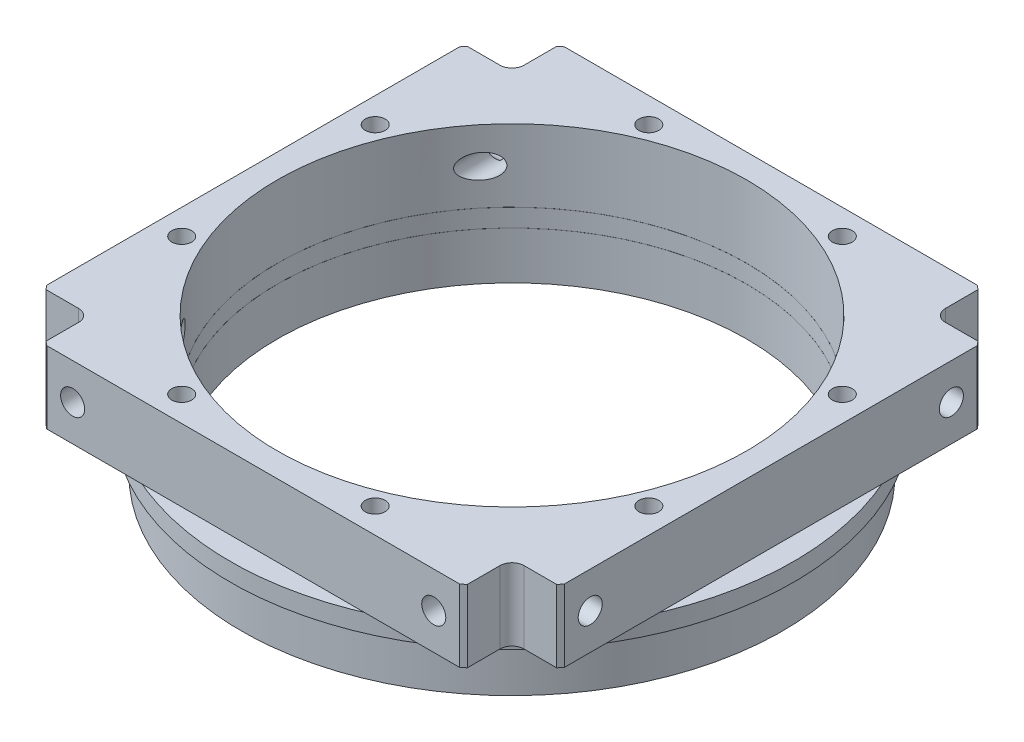
from build123d import *

# Parameters (mm, degrees)
SKETCH_2_OUTSIDE_W          = 143.448
SKETCH_2_OUTSIDE_H          = 143.448
SKETCH_2_OUTSIDE_W_2        = 86
SKETCH_2_OUTSIDE_H_2        = 86
CUT_EXTRUDE_1_DEPTH         = 12
SKETCH_4_R                  = 2
CUT_EXTRUDE_3_DEPTH         = 104.820470043
SKETCH_5_R                  = 2
CUT_EXTRUDE_4_DEPTH         = 12
CUT_EXTRUDE_START           = -74
SKETCH_5_2_R                = 2
CUT_EXTRUDE_5_DEPTH         = 12
SKETCH_6_R                  = 1.65
CUT_EXTRUDE_6_DEPTH         = 100
SKETCH_10_R                 = 2.1
CUT_EXTRUDE_8_DEPTH         = 10.9
PATTERN_CIRCULAR_1_COUNT    = 8
CUT_EXTRUDE_7_DEPTH         = 20
CUT_EXTRUDE_3326_DEPTH      = 71.034919894
CUT_EXTRUDE_3326_DEPTH_BACK = 71.034919894
SKETCH_11_W                 = 136.197392648
SKETCH_11_H                 = 0.01


with BuildPart() as part:
    # 草图1 → 旋转1 (revolve)
    with BuildSketch(Plane.XY, mode=Mode.PRIVATE) as revolve_1_sk:
        Polygon((-39, 0), (-45, 0), (-45, 7.9), (-46.8, 7.9), (-46.8, 10.9), (-55, 10.9), (-55, 22.9), (-39, 22.9), align=None)
    revolve(revolve_1_sk.sketch.rotate(Axis((0, 0, 0), (0, 1, 0)), 270), axis=Axis((0, 0, 0), (0, 1, 0)))

    # 草图2 outside → 切除-拉伸1 (cut)
    with BuildSketch(Plane(origin=(0, 22.9, 0), x_dir=(1, 0, 0), z_dir=(0, 1, 0))):
        Rectangle(SKETCH_2_OUTSIDE_W, SKETCH_2_OUTSIDE_H)
        Rectangle(SKETCH_2_OUTSIDE_W_2, SKETCH_2_OUTSIDE_H_2, mode=Mode.SUBTRACT)
    extrude(amount=-CUT_EXTRUDE_1_DEPTH, mode=Mode.SUBTRACT)

    # 草图4 → 切除-拉伸3 (cut, through all)
    with BuildSketch(Plane.XY.offset(43)):
        with Locations((-30, 16.9)):
            Circle(SKETCH_4_R)
        with Locations((30, 16.9)):
            Circle(SKETCH_4_R)
    extrude(amount=-CUT_EXTRUDE_3_DEPTH, mode=Mode.SUBTRACT)

    # 草图5 → 切除-拉伸4 (cut)
    with BuildSketch(Plane.ZY.offset(43)):
        with Locations((-30, 16.9)):
            Circle(SKETCH_5_R)
        with Locations((30, 16.9)):
            Circle(SKETCH_5_R)
    extrude(amount=-CUT_EXTRUDE_4_DEPTH, mode=Mode.SUBTRACT)

    # 草图5<2> → 切除-拉伸5 (cut)
    with BuildSketch(Plane.ZY.offset(43).offset(CUT_EXTRUDE_START)):
        with Locations((-30, 16.9)):
            Circle(SKETCH_5_2_R)
        with Locations((30, 16.9)):
            Circle(SKETCH_5_2_R)
    extrude(amount=-CUT_EXTRUDE_5_DEPTH, mode=Mode.SUBTRACT)

    # 草图6 → 切除-拉伸6 (cut)
    with BuildSketch(Plane.XZ):
        with Locations(Location((-16.072704159, -38.802940365, 0), (0, 0, 270))):
            Circle(SKETCH_6_R)
    cut_extrude_6 = extrude(amount=-CUT_EXTRUDE_6_DEPTH, mode=Mode.SUBTRACT)

    # 草图10 → 切除-拉伸8 (cut)
    with BuildSketch(Plane.XZ):
        with Locations(Location((-16.072704159, -38.802940365, 0), (0, 0, 270))):
            Circle(SKETCH_10_R)
    cut_extrude_8 = extrude(amount=-CUT_EXTRUDE_8_DEPTH, mode=Mode.SUBTRACT)

    # 阵列(圆周)1: 切除-拉伸6, 切除-拉伸8 ×8 about axis
    pattern_circular_1_axis = Axis((0, 0, 0), (0, 1, 0))
    add([cut_extrude_6.rotate(pattern_circular_1_axis, i * 360 / PATTERN_CIRCULAR_1_COUNT) for i in range(1, PATTERN_CIRCULAR_1_COUNT)], mode=Mode.SUBTRACT)
    add([cut_extrude_8.rotate(pattern_circular_1_axis, i * 360 / PATTERN_CIRCULAR_1_COUNT) for i in range(1, PATTERN_CIRCULAR_1_COUNT)], mode=Mode.SUBTRACT)

    # 草图7 → 切除-拉伸7 (cut)
    with BuildSketch(Plane(origin=(0, 22.9, 0), x_dir=(1, 0, 0), z_dir=(0, 1, 0))):
        with BuildLine():
            Line((-37, 35), (-53, 35))
            ThreePointArc((-53, 35), (-54.414213562, 35.585786438), (-55, 37))
            Line((-55, 37), (-55, 53))
            ThreePointArc((-55, 53), (-54.414213562, 54.414213562), (-53, 55))
            Line((-53, 55), (-37, 55))
            ThreePointArc((-37, 55), (-35.585786438, 54.414213562), (-35, 53))
            Line((-35, 53), (-35, 37))
            ThreePointArc((-35, 37), (-35.585786438, 35.585786438), (-37, 35))
        make_face()
        with BuildLine():
            Line((37, 35), (53, 35))
            ThreePointArc((53, 35), (54.414213562, 35.585786438), (55, 37))
            Line((55, 37), (55, 53))
            ThreePointArc((55, 53), (54.414213562, 54.414213562), (53, 55))
            Line((53, 55), (37, 55))
            ThreePointArc((37, 55), (35.585786438, 54.414213562), (35, 53))
            Line((35, 53), (35, 37))
            ThreePointArc((35, 37), (35.585786438, 35.585786438), (37, 35))
        make_face()
        with BuildLine():
            Line((37, -35), (53, -35))
            ThreePointArc((53, -35), (54.414213562, -35.585786438), (55, -37))
            Line((55, -37), (55, -53))
            ThreePointArc((55, -53), (54.414213562, -54.414213562), (53, -55))
            Line((53, -55), (37, -55))
            ThreePointArc((37, -55), (35.585786438, -54.414213562), (35, -53))
            Line((35, -53), (35, -37))
            ThreePointArc((35, -37), (35.585786438, -35.585786438), (37, -35))
        make_face()
        with BuildLine():
            Line((-37, -35), (-53, -35))
            ThreePointArc((-53, -35), (-54.414213562, -35.585786438), (-55, -37))
            Line((-55, -37), (-55, -53))
            ThreePointArc((-55, -53), (-54.414213562, -54.414213562), (-53, -55))
            Line((-53, -55), (-37, -55))
            ThreePointArc((-37, -55), (-35.585786438, -54.414213562), (-35, -53))
            Line((-35, -53), (-35, -37))
            ThreePointArc((-35, -37), (-35.585786438, -35.585786438), (-37, -35))
        make_face()
    extrude(amount=-CUT_EXTRUDE_7_DEPTH, mode=Mode.SUBTRACT)

    # 草图11 → Cut-Extrude 3326 (cut, two sides: drawn at the far end of the back side and taken through both)
    with BuildSketch(Plane(origin=(0, 0, 0), x_dir=(0, 0, -1), z_dir=(1, 0, 0)).offset(-CUT_EXTRUDE_3326_DEPTH_BACK)):
        with Locations((-5.996836933, 7.895)):
            Rectangle(SKETCH_11_W, SKETCH_11_H)
        with Locations((-5.996836933, 10.895)):
            Rectangle(SKETCH_11_W, SKETCH_11_H)
    extrude(amount=CUT_EXTRUDE_3326_DEPTH + CUT_EXTRUDE_3326_DEPTH_BACK, mode=Mode.SUBTRACT)


with BuildPart() as cut_extrude_3326_piece_1:
    # of the separate pieces the step leaves, piece 1, a body of its own (cut_extrude_3326_pieces)
    add(part.part.solids().sort_by_distance((40.452940365, 10.9, -16.072704159))[0])


with BuildPart() as cut_extrude_3326_piece_2:
    # of the separate pieces the step leaves, piece 2, a body of its own (cut_extrude_3326_pieces)
    add(part.part.solids().sort_by_distance((0, 0, -45))[0])


with BuildPart() as cut_extrude_3326_piece_3:
    # of the separate pieces the step leaves, piece 3, a body of its own (cut_extrude_3326_pieces)
    add(part.part.solids().sort_by_distance((0, 7.9, -46.8))[0])


solid = Compound([cut_extrude_3326_piece_1.part, cut_extrude_3326_piece_2.part, cut_extrude_3326_piece_3.part])
